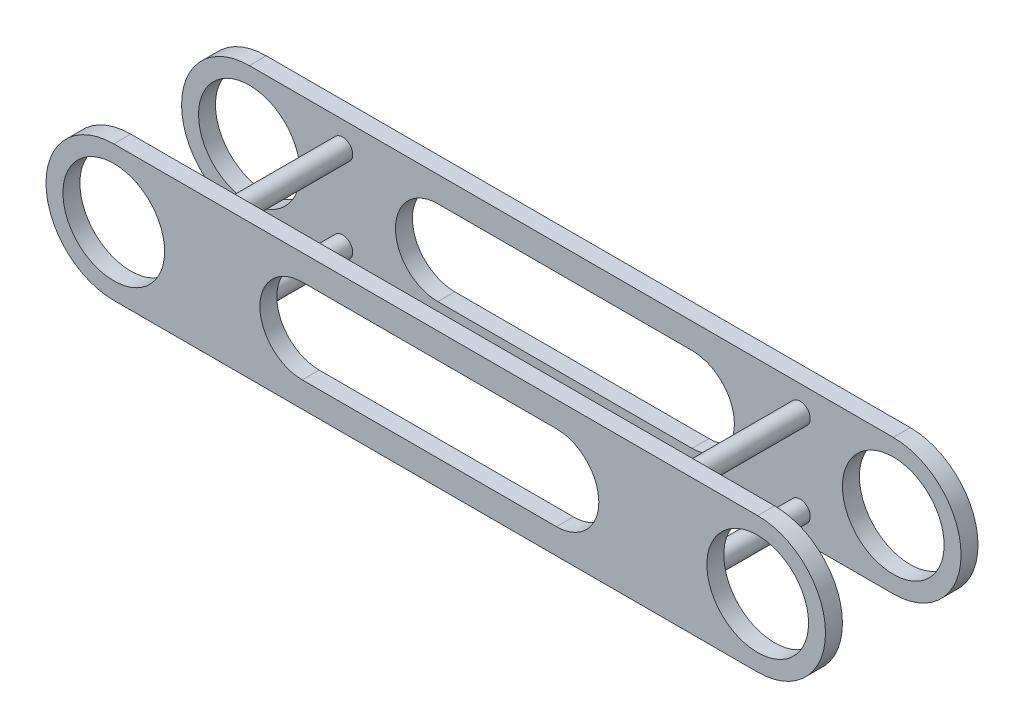
from build123d import *

# Parameters (mm, degrees)
SKETCH1_R           = 30
BOSS_EXTRUDE1_DEPTH = 52.5
BOSS_EXTRUDE2_DEPTH = 10
CUT_EXTRUDE1_DEPTH  = 434.01991871
SKETCH4_R           = 30
BOSS_EXTRUDE3_DEPTH = 52.5
SKETCH5_R           = 6
BOSS_EXTRUDE4_DEPTH = 80
SKETCH6_R           = 30
CUT_EXTRUDE2_DEPTH  = 435.770054167


with BuildPart() as part:
    # Sketch1 → Boss-Extrude1 (new, symmetric)
    with BuildSketch(Plane.XY):
        Circle(SKETCH1_R)
    extrude(amount=BOSS_EXTRUDE1_DEPTH, both=True)

    # Sketch2 → Boss-Extrude2 (add)
    with BuildSketch(Plane.XY.offset(45)):
        with BuildLine():
            Line((0, 40), (380, 40))
            ThreePointArc((380, 40), (420, 0), (380, -40))
            Line((380, -40), (0, -40))
            ThreePointArc((0, -40), (-40, 0), (0, 40))
        make_face()
    boss_extrude2 = extrude(amount=-BOSS_EXTRUDE2_DEPTH)

    # Sketch3 → Cut-Extrude1 (cut, through all)
    with BuildSketch(Plane.XY.offset(45)):
        with BuildLine():
            Line((111.232355061, 25), (261.232355061, 25))
            ThreePointArc((261.232355061, 25), (286.232355061, 0), (261.232355061, -25))
            Line((261.232355061, -25), (111.232355061, -25))
            ThreePointArc((111.232355061, -25), (86.232355061, 0), (111.232355061, 25))
        make_face()
    cut_extrude1 = extrude(amount=-CUT_EXTRUDE1_DEPTH, mode=Mode.SUBTRACT)

    # Sketch4 → Boss-Extrude3 (add, symmetric)
    with BuildSketch(Plane.XY):
        with Locations((380, 0)):
            Circle(SKETCH4_R)
    extrude(amount=BOSS_EXTRUDE3_DEPTH, both=True)

    # Mirror1: Boss-Extrude2, Cut-Extrude1 across plane
    add(boss_extrude2.mirror(Plane.XY))
    add(cut_extrude1.mirror(Plane.XY), mode=Mode.SUBTRACT)

    # Sketch5 → Boss-Extrude4 (add)
    with BuildSketch(Plane(origin=(0, 0, -45), x_dir=(-1, 0, 0), z_dir=(0, 0, -1))):
        with Locations((-325, 25)):
            Circle(SKETCH5_R)
        with Locations((-325, -25)):
            Circle(SKETCH5_R)
        with Locations((-55, -25)):
            Circle(SKETCH5_R)
        with Locations((-55, 25)):
            Circle(SKETCH5_R)
    extrude(amount=-BOSS_EXTRUDE4_DEPTH)

    # Sketch6 → Cut-Extrude2 (cut, through all)
    with BuildSketch(Plane(origin=(0, 0, -52.5), x_dir=(-1, 0, 0), z_dir=(0, 0, -1))):
        with Locations(Location((-380, 0, 0), (0, 0, 180))):
            Circle(SKETCH6_R)
        with Locations(Location((0, 0, 0), (0, 0, 180))):
            Circle(SKETCH6_R)
    extrude(amount=-CUT_EXTRUDE2_DEPTH, mode=Mode.SUBTRACT)


solid = part.part
